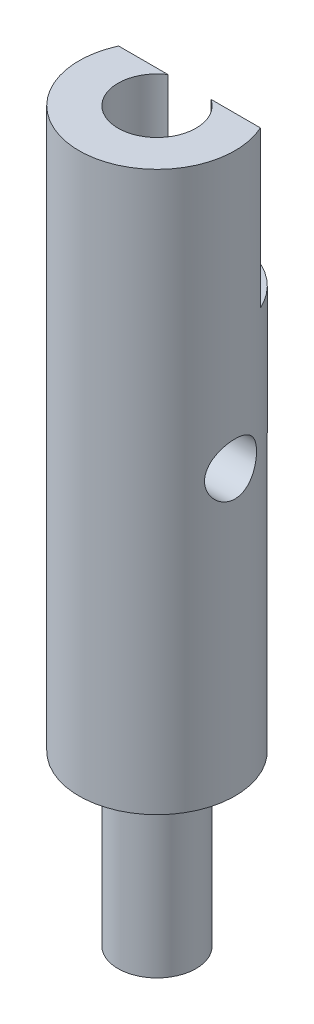
from build123d import *

# Parameters (mm, degrees)
SKETCH_1_R               = 6
EXTRUDE_1_DEPTH          = 56
CUT_EXTRUDE_START        = -12
CUT_EXTRUDE_1_DEPTH      = 12
SKETCH_3_R               = 6
SKETCH_3_R_2             = 3
CUT_EXTRUDE_2_DEPTH      = 13
CUT_EXTRUDE_6_DEPTH      = 57.639209034
CUT_EXTRUDE_6_DEPTH_BACK = 57.639209034
SKETCH_6_R               = 2


with BuildPart() as part:
    # ｽｹｯﾁ1 → ﾎﾞｽ - 押し出し1 (new body)
    with BuildSketch(Plane(origin=(0, 0, 0), x_dir=(1, 0, 0), z_dir=(0, 1, 0))):
        with Locations(Location((0, 0, 0), (0, 0, 270))):
            Circle(SKETCH_1_R)
    extrude(amount=EXTRUDE_1_DEPTH)

    # ｽｹｯﾁ2 → ｶｯﾄ - 押し出し1 (cut)
    with BuildSketch(Plane(origin=(0, 56, 0), x_dir=(1, 0, 0), z_dir=(0, 1, 0)).offset(CUT_EXTRUDE_START)):
        with BuildLine():
            Line((1.658312395, 2.5), (5.454356057, 2.5))
            ThreePointArc((5.454356057, 2.5), (0, 6), (-5.454356057, 2.5))
            Line((-5.454356057, 2.5), (-1.658312395, 2.5))
            ThreePointArc((-1.658312395, 2.5), (0, -3), (1.658312395, 2.5))
        make_face()
    extrude(amount=CUT_EXTRUDE_1_DEPTH, mode=Mode.SUBTRACT)

    # ｽｹｯﾁ3 → ｶｯﾄ - 押し出し2 (cut)
    with BuildSketch(Plane.XZ):
        with Locations(Location((0, 0, 0), (0, 0, 270))):
            Circle(SKETCH_3_R)
        with Locations(Location((0, 0, 0), (0, 0, 270))):
            Circle(SKETCH_3_R_2, mode=Mode.SUBTRACT)
    extrude(amount=-CUT_EXTRUDE_2_DEPTH, mode=Mode.SUBTRACT)

    # ｽｹｯﾁ6 → ｶｯﾄ - 押し出し6 (cut, two sides: drawn at the far end of the back side and taken through both)
    with BuildSketch(Plane(origin=(0, 0, 0), x_dir=(0, 0, -1), z_dir=(1, 0, 0)).offset(-CUT_EXTRUDE_6_DEPTH_BACK)):
        with Locations((0, 34.8)):
            Circle(SKETCH_6_R)
    extrude(amount=CUT_EXTRUDE_6_DEPTH + CUT_EXTRUDE_6_DEPTH_BACK, mode=Mode.SUBTRACT)


solid = part.part
